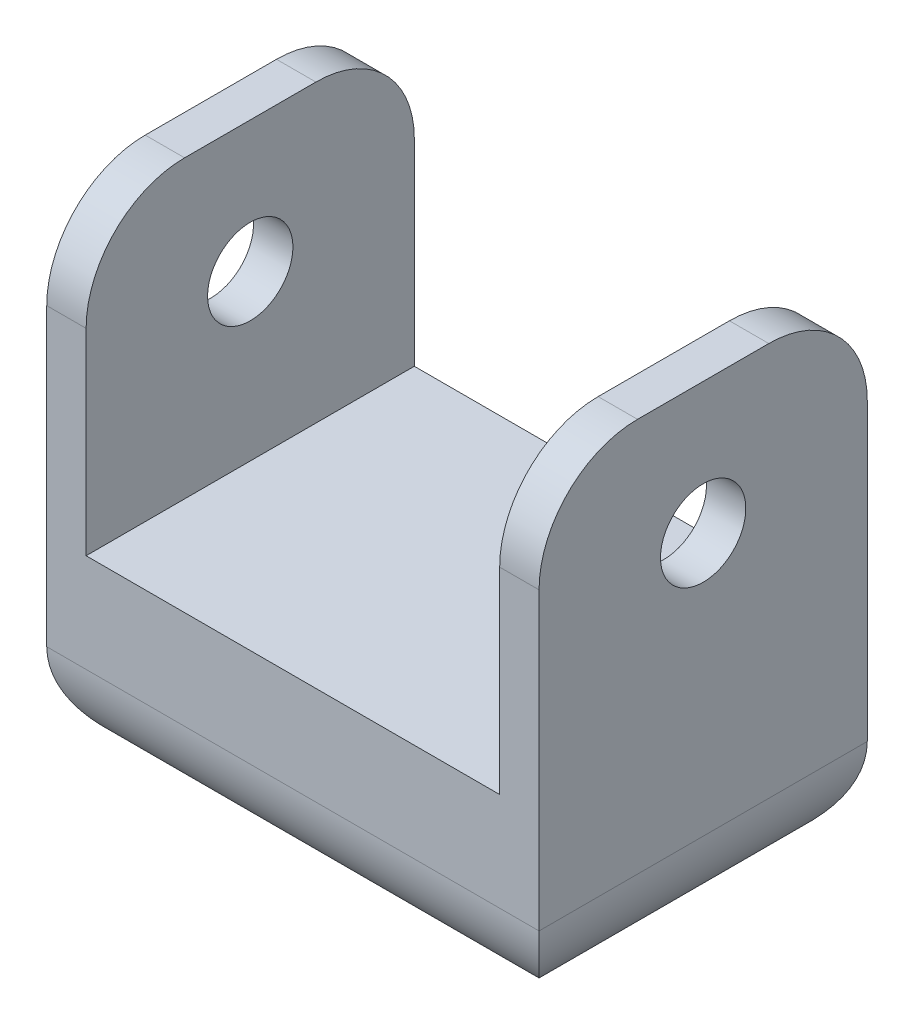
from build123d import *

# Parameters (mm, degrees)
SKETCH1_W           = 38.1
SKETCH1_H           = 25.4
BOSS_EXTRUDE1_DEPTH = 25.4
SKETCH2_W           = 32.004
SKETCH2_H           = 25.4
CUT_EXTRUDE1_DEPTH  = 22.86
SKETCH3_R           = 3.302
CUT_EXTRUDE2_DEPTH  = 48.519048812
FILLET1_R           = 7.62
SKETCH4_W           = 38.1
SKETCH4_H           = 25.4
BOSS_EXTRUDE2_DEPTH = 12.7
FILLET2_R           = 7.62


with BuildPart() as part:
    # Sketch1 → Boss-Extrude1 (new body)
    with BuildSketch(Plane(origin=(0, 0, 0), x_dir=(1, 0, 0), z_dir=(0, 1, 0))):
        Rectangle(SKETCH1_W, SKETCH1_H)
    extrude(amount=BOSS_EXTRUDE1_DEPTH)

    # Sketch2 → Cut-Extrude1 (cut)
    with BuildSketch(Plane(origin=(0, 25.4, 0), x_dir=(1, 0, 0), z_dir=(0, 1, 0))):
        Rectangle(SKETCH2_W, SKETCH2_H)
    extrude(amount=-CUT_EXTRUDE1_DEPTH, mode=Mode.SUBTRACT)

    # Sketch3 → Cut-Extrude2 (cut, through all)
    with BuildSketch(Plane.ZY.offset(19.05)):
        with Locations((0, 15.24)):
            Circle(SKETCH3_R)
    extrude(amount=-CUT_EXTRUDE2_DEPTH, mode=Mode.SUBTRACT)

    # Fillet1
    fillet1_edges = [part.edges().sort_by_distance(p)[0] for p in [
        (-17.526, 25.4, -12.7),
        (17.526, 25.4, 12.7),
        (-17.526, 25.4, 12.7),
        (17.526, 25.4, -12.7),
    ]]
    fillet(fillet1_edges, radius=FILLET1_R)

    # Sketch4 → Boss-Extrude2 (add)
    with BuildSketch(Plane.XZ):
        Rectangle(SKETCH4_W, SKETCH4_H)
    extrude(amount=BOSS_EXTRUDE2_DEPTH)

    # Fillet2
    fillet2_edges = [part.edges().sort_by_distance(p)[0] for p in [
        (-19.05, -12.7, 0),
        (0, -12.7, -12.7),
        (19.05, -12.7, 0),
        (0, -12.7, 12.7),
    ]]
    fillet(fillet2_edges, radius=FILLET2_R)


solid = part.part
